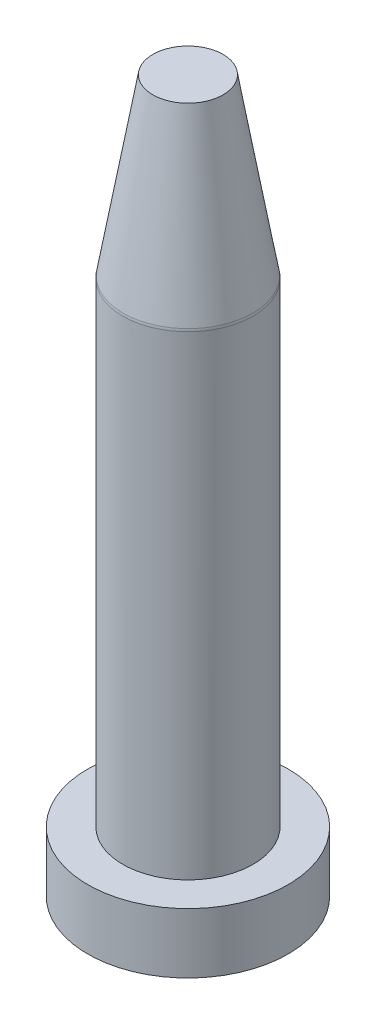
from build123d import *

# Parameters (mm, degrees)
FILLET_1_R = 3


with BuildPart() as part:
    # 草图1 → Revolve 292 (revolve)
    with BuildSketch(Plane.XY, mode=Mode.PRIVATE) as revolve_292_sk:
        Polygon((0, 0), (20, 0), (20, 12), (13, 12), (13, 107), (7, 142), (0, 142), align=None)
    revolve(revolve_292_sk.sketch.rotate(Axis((0, 0, 0), (0, 1, 0)), 90), axis=Axis((0, 0, 0), (0, 1, 0)))

    # 圆角1
    fillet_1_edges = [part.edges().sort_by_distance(p)[0] for p in [
        (0, 107, 13),
    ]]
    fillet(fillet_1_edges, radius=FILLET_1_R)


solid = part.part
